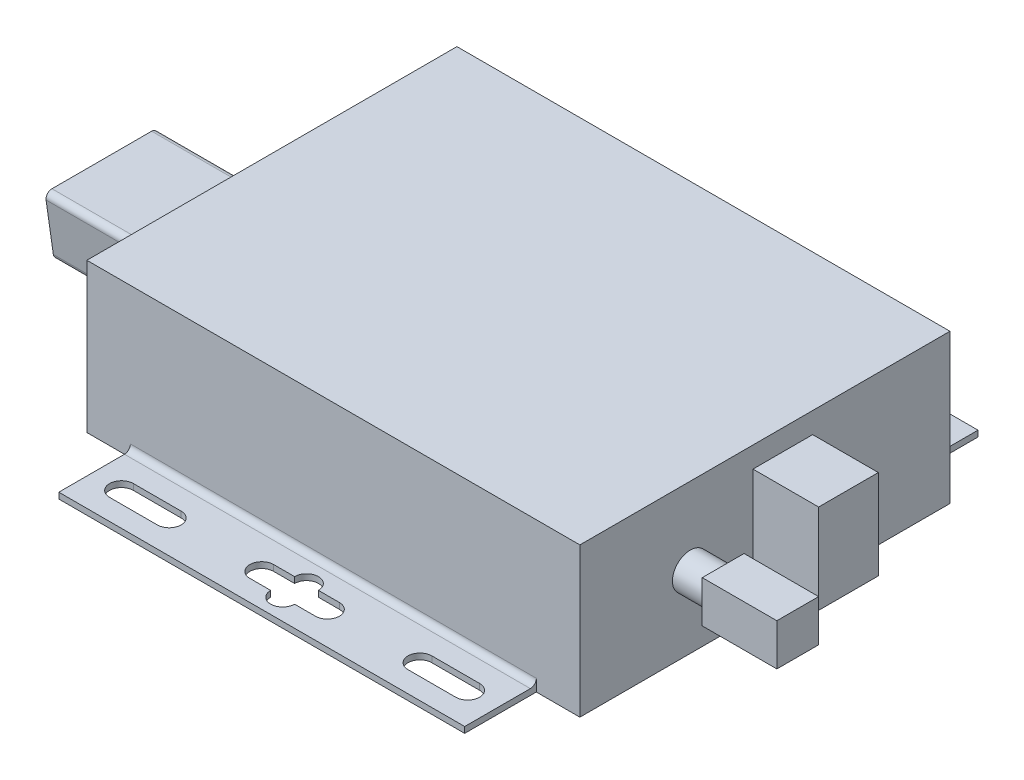
from build123d import *

# Parameters (mm, degrees)
SKETCH_1_W      = 82.6
SKETCH_1_H      = 62
EXTRUDE_1_DEPTH = 25
SKETCH_2_W      = 68
SKETCH_2_H      = 12
EXTRUDE_2_DEPTH = 1
FILLET_1_R      = 1
SKETCH_3_R      = 3
EXTRUDE_3_DEPTH = 5.5
SKETCH_4_W      = 10
SKETCH_4_H      = 15
EXTRUDE_4_DEPTH = 11
SKETCH_5_W      = 31
SKETCH_5_H      = 12.5
EXTRUDE_5_DEPTH = 5
EXTRUDE_6_DEPTH = 15
FILLET_2_R      = 1
SKETCH_7_W      = 7
SKETCH_7_H      = 7
EXTRUDE_7_DEPTH = 12.5


with BuildPart() as part:
    # 草图1 → 凸台-拉伸1 (new body)
    with BuildSketch(Plane(origin=(0, 0, 0), x_dir=(1, 0, 0), z_dir=(0, 1, 0))):
        Rectangle(SKETCH_1_W, SKETCH_1_H)
    extrude(amount=EXTRUDE_1_DEPTH)

    # 草图2 → 凸台-拉伸2 (add)
    # profile 1 of 2: a face of its own
    with BuildSketch(Plane.XZ):
        with Locations((0, 37)):
            Rectangle(SKETCH_2_W, SKETCH_2_H)
        with BuildLine():
            Line((-29, 39.5), (-21, 39.5))
            ThreePointArc((-21, 39.5), (-19, 37.5), (-21, 35.5))
            Line((-21, 35.5), (-29, 35.5))
            ThreePointArc((-29, 35.5), (-31, 37.5), (-29, 39.5))
        make_face(mode=Mode.SUBTRACT)
        with BuildLine():
            Line((21, 39.5), (29, 39.5))
            ThreePointArc((29, 39.5), (31, 37.5), (29, 35.5))
            Line((29, 35.5), (21, 35.5))
            ThreePointArc((21, 35.5), (19, 37.5), (21, 39.5))
        make_face(mode=Mode.SUBTRACT)
        with BuildLine():
            Line((-5.5, 39.5), (-2, 39.5))
            ThreePointArc((-2, 39.5), (0, 41.5), (2, 39.5))
            Line((2, 39.5), (5.5, 39.5))
            ThreePointArc((5.5, 39.5), (7.5, 37.5), (5.5, 35.5))
            Line((5.5, 35.5), (2, 35.5))
            ThreePointArc((2, 35.5), (0, 33.5), (-2, 35.5))
            Line((-2, 35.5), (-5.5, 35.5))
            ThreePointArc((-5.5, 35.5), (-7.5, 37.5), (-5.5, 39.5))
        make_face(mode=Mode.SUBTRACT)
    # profile 2 of 2: a face of its own
    with BuildSketch(Plane.XZ):
        with Locations((0, -37)):
            Rectangle(SKETCH_2_W, SKETCH_2_H)
        with BuildLine():
            Line((2, -35.5), (5.5, -35.5))
            ThreePointArc((5.5, -35.5), (7.5, -37.5), (5.5, -39.5))
            Line((5.5, -39.5), (2, -39.5))
            ThreePointArc((2, -39.5), (0, -41.5), (-2, -39.5))
            Line((-2, -39.5), (-5.5, -39.5))
            ThreePointArc((-5.5, -39.5), (-7.5, -37.5), (-5.5, -35.5))
            Line((-5.5, -35.5), (-2, -35.5))
            ThreePointArc((-2, -35.5), (0, -33.5), (2, -35.5))
        make_face(mode=Mode.SUBTRACT)
        with BuildLine():
            Line((21, -39.5), (29, -39.5))
            ThreePointArc((29, -39.5), (31, -37.5), (29, -35.5))
            Line((29, -35.5), (21, -35.5))
            ThreePointArc((21, -35.5), (19, -37.5), (21, -39.5))
        make_face(mode=Mode.SUBTRACT)
        with BuildLine():
            Line((-29, -39.5), (-21, -39.5))
            ThreePointArc((-21, -39.5), (-19, -37.5), (-21, -35.5))
            Line((-21, -35.5), (-29, -35.5))
            ThreePointArc((-29, -35.5), (-31, -37.5), (-29, -39.5))
        make_face(mode=Mode.SUBTRACT)
    extrude(amount=-EXTRUDE_2_DEPTH)

    # 圆角1
    fillet_1_edges = [part.edges().sort_by_distance(p)[0] for p in [
        (0, 1, 31),
        (0, 1, -31),
    ]]
    fillet(fillet_1_edges, radius=FILLET_1_R)

    # 草图3 → 凸台-拉伸3 (add)
    with BuildSketch(Plane(origin=(41.3, 0, 0), x_dir=(0, 0, -1), z_dir=(1, 0, 0))):
        with Locations(Location((-12.5, 12, 0), (0, 0, 180))):
            Circle(SKETCH_3_R)
    extrude(amount=EXTRUDE_3_DEPTH)

    # 草图4 → 凸台-拉伸4 (add)
    with BuildSketch(Plane(origin=(41.3, 0, 0), x_dir=(0, 0, -1), z_dir=(1, 0, 0))):
        with Locations((3, 14)):
            Rectangle(SKETCH_4_W, SKETCH_4_H)
    extrude(amount=EXTRUDE_4_DEPTH)

    # 草图5 → 凸台-拉伸5 (add)
    with BuildSketch(Plane.ZY.offset(41.3)):
        with Locations((8.5, 13.05)):
            Rectangle(SKETCH_5_W, SKETCH_5_H)
    extrude(amount=EXTRUDE_5_DEPTH)

    # 草图6 → 凸台-拉伸6 (add)
    with BuildSketch(Plane.ZY.offset(46.3)):
        Polygon((-1, 18.3), (18, 18.3), (16.5, 7.8), (0.5, 7.8), align=None)
    extrude(amount=EXTRUDE_6_DEPTH)

    # 圆角2
    fillet_2_edges = [part.edges().sort_by_distance(p)[0] for p in [
        (-53.8, 18.3, -1),
        (-53.8, 7.8, 0.5),
        (-53.8, 7.8, 16.5),
        (-53.8, 18.3, 18),
    ]]
    fillet(fillet_2_edges, radius=FILLET_2_R)

    # 草图7 → 凸台-拉伸7 (add)
    with BuildSketch(Plane(origin=(46.8, 0, 0), x_dir=(0, 0, -1), z_dir=(1, 0, 0))):
        with Locations((-12.5, 12)):
            Rectangle(SKETCH_7_W, SKETCH_7_H)
    extrude(amount=EXTRUDE_7_DEPTH)


solid = part.part
